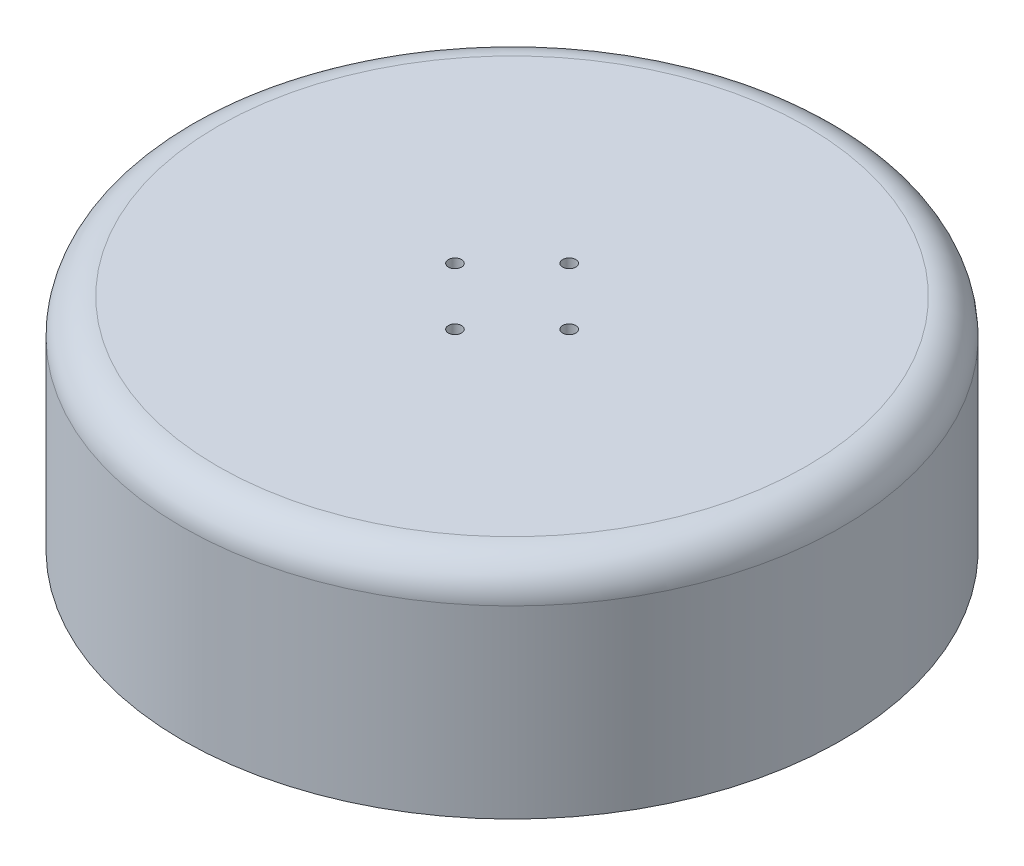
from build123d import *

# Parameters (mm, degrees)
SKETCH1_R           = 75
BOSS_EXTRUDE1_DEPTH = 50
FILLET1_R           = 8
SKETCH2_R           = 1.5
CUT_EXTRUDE1_DEPTH  = 4


with BuildPart() as part:
    # Sketch1 → Boss-Extrude1 (new body)
    with BuildSketch(Plane(origin=(0, 0, 0), x_dir=(1, 0, 0), z_dir=(0, 1, 0))):
        with Locations(Location((0, 0, 0), (0, 0, 270))):
            Circle(SKETCH1_R)
    extrude(amount=BOSS_EXTRUDE1_DEPTH)

    # Fillet1
    fillet1_edges = [part.edges().sort_by_distance(p)[0] for p in [
        (0, 50, -75),
    ]]
    fillet(fillet1_edges, radius=FILLET1_R)

    # Sketch2 → Cut-Extrude1 (cut)
    with BuildSketch(Plane(origin=(0, 50, 0), x_dir=(1, 0, 0), z_dir=(0, 1, 0))):
        with Locations(Location((0, 13, 0), (0, 0, 270))):
            Circle(SKETCH2_R)
        with Locations(Location((13, 0, 0), (0, 0, 270))):
            Circle(SKETCH2_R)
        with Locations(Location((0, -13, 0), (0, 0, 270))):
            Circle(SKETCH2_R)
        with Locations(Location((-13, 0, 0), (0, 0, 270))):
            Circle(SKETCH2_R)
    extrude(amount=-CUT_EXTRUDE1_DEPTH, mode=Mode.SUBTRACT)


solid = part.part
